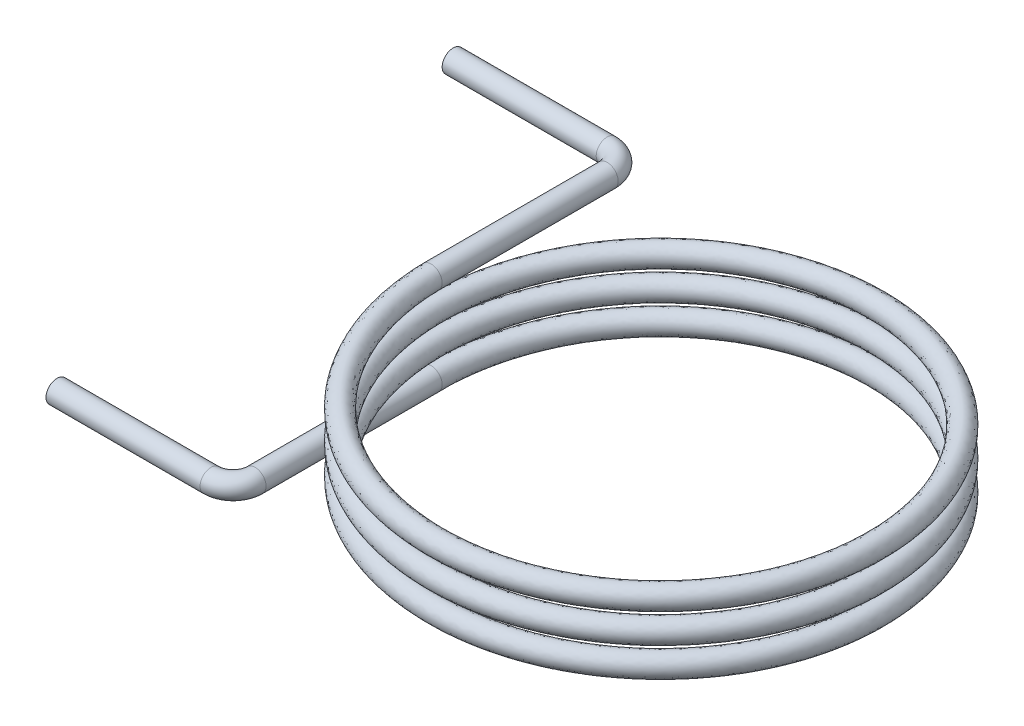
from build123d import *

# Parameters (mm, degrees)
SWEEP2_PITCH       = 0.666666667
SWEEP2_HEIGHT      = 2
SWEEP2_RADIUS      = 5
SWEEP2_START_ANGLE = -90
SCHIZZO4_R         = 0.25
SWEEP3_PROFILE_R   = 0.25
SWEEP4_PROFILE_R   = 0.25


with BuildPart() as part:
    # Sweep2: sweep along a helix
    with BuildLine() as sweep2_path:
        add(Helix(SWEEP2_PITCH, SWEEP2_HEIGHT, SWEEP2_RADIUS, center=(0, 0, 0), direction=(0, 1, 0), lefthand=True, mode=Mode.PRIVATE).rotate(Axis((0, 0, 0), (0, 1, 0)), SWEEP2_START_ANGLE))
    # Schizzo4 → Sweep2 (sweep)
    with BuildSketch(Plane.XY):
        with Locations((-5, 0)):
            Circle(SCHIZZO4_R)
    sweep(path=sweep2_path.line, is_frenet=True)

    # Sweep3: sweep along a curve in space
    with BuildLine() as sweep3_path:
        Line((-5, 2, 0), (-5, 2, -4))
        ThreePointArc((-5, 2, -4), (-5.146446609, 2, -4.353553391), (-5.5, 2, -4.5))
        Line((-5.5, 2, -4.5), (-9, 2, -4.5))
    # Sweep3 profile (on start of the path) → Sweep3 (sweep)
    with BuildSketch(Plane(origin=(-5, 2, 0), x_dir=(0, -1, 0), z_dir=(0, 0, -1))):
        Circle(SWEEP3_PROFILE_R)
    sweep(path=sweep3_path.line)

    # Sweep4: sweep along a curve in space
    with BuildLine() as sweep4_path:
        Line((-5, 0, 0), (-5, 0, 4))
        ThreePointArc((-5, 0, 4), (-5.146446609, 0, 4.353553391), (-5.5, 0, 4.5))
        Line((-5.5, 0, 4.5), (-9, 0, 4.5))
    # Sweep4 profile (on start of the path) → Sweep4 (sweep)
    with BuildSketch(Plane(origin=(-5, 0, 0), x_dir=(1, 0, 0), z_dir=(0, 0, 1))):
        Circle(SWEEP4_PROFILE_R)
    sweep(path=sweep4_path.line)


solid = part.part
